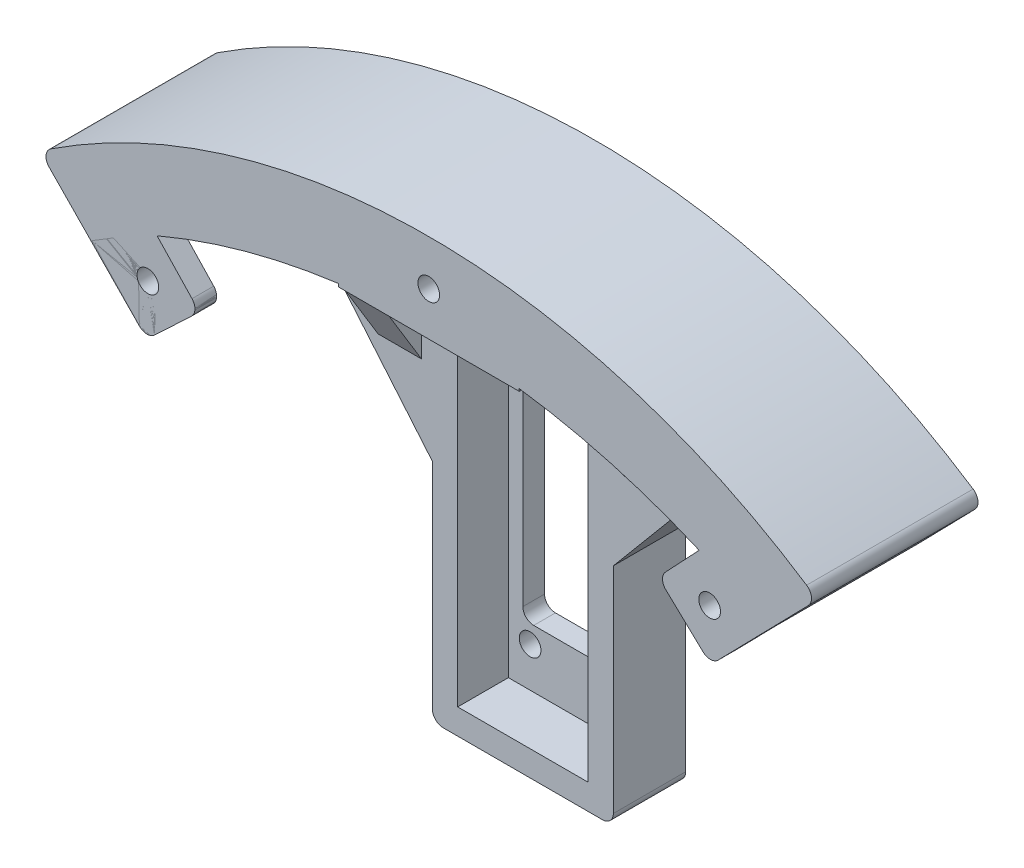
from build123d import *

# Parameters (mm, degrees)
CROQUIS1_R              = 100
SALIENTE_EXTRUIR1_DEPTH = 3
CROQUIS3_R              = 110
CORTAR_EXTRUIR1_DEPTH   = 3
REDONDEO1_R             = 10
CORTAR_EXTRUIR6_DEPTH   = 10
CROQUIS12_R             = 1.5
CORTAR_EXTRUIR7_DEPTH   = 142.453172607
CROQUIS9_R              = 1.5
CROQUIS9_W              = 4.5
CROQUIS9_H              = 8
CROQUIS9_W_2            = 8
CROQUIS9_H_2            = 4.5
CORTAR_EXTRUIR5_DEPTH   = 10
CORTAR_EXTRUIR9_DEPTH   = 142.453172607
SALIENTE_EXTRUIR3_DEPTH = 3
SALIENTE_EXTRUIR4_DEPTH = 23
CROQUIS23_W             = 25
CROQUIS23_H             = 75
SALIENTE_EXTRUIR5_DEPTH = 23
CROQUIS24_W             = 25
CROQUIS24_H             = 13
CORTAR_EXTRUIR10_DEPTH  = 58.5
CORTAR_EXTRUIR11_DEPTH  = 20
CROQUIS27_W             = 18
CROQUIS27_H             = 51.5
CORTAR_EXTRUIR12_DEPTH  = 7
CROQUIS28_R             = 1.5
CROQUIS28_W             = 14
CROQUIS28_H             = 37
CORTAR_EXTRUIR13_DEPTH  = 7
CROQUIS30_R             = 1.5
CORTAR_EXTRUIR14_DEPTH  = 5
REDONDEO2_R             = 1.5
REDONDEO3_R             = 1.5
REDONDEO4_R             = 1.5
CROQUIS33_R             = 100
CROQUIS33_R_2           = 95
CORTAR_EXTRUIR15_DEPTH  = 118.101726702
REDONDEO5_R             = 1.5
SALIENTE_EXTRUIR6_DEPTH = 10
SALIENTE_EXTRUIR7_DEPTH = 6


with BuildPart() as part:
    # Croquis1 → Saliente-Extruir1 (new body)
    with BuildSketch(Plane.XY):
        Circle(CROQUIS1_R)
    extrude(amount=SALIENTE_EXTRUIR1_DEPTH)

    # Croquis3 → Cortar-Extruir1 (cut)
    with BuildSketch(Plane.XY.offset(3)):
        with Locations((190, 0)):
            Circle(CROQUIS3_R)
    extrude(amount=-CORTAR_EXTRUIR1_DEPTH, mode=Mode.SUBTRACT)

    # Redondeo1
    redondeo1_edges = [part.edges().sort_by_distance(p)[0] for p in [
        (89.473684211, -44.659375654, 1.5),
        (89.473684211, 44.659375654, 1.5),
    ]]
    fillet(redondeo1_edges, radius=REDONDEO1_R)

    # Croquis5 → Cortar-Extruir6 (cut)
    with BuildSketch(Plane.XY.offset(3)):
        Polygon((-58.336309448, -83.085046789), (-83.085046789, -58.336309448), (-65.40737726, -40.658639918), (-40.658639918, -65.40737726), align=None)
        Polygon((-83.085046789, 58.336309448), (-58.336309448, 83.085046789), (-40.658639918, 65.40737726), (-65.40737726, 40.658639918), align=None)
        Polygon((58.336309448, -83.085046789), (83.085046789, -58.336309448), (65.40737726, -40.658639918), (40.658639918, -65.40737726), align=None)
        Polygon((58.336309448, 83.085046789), (83.085046789, 58.336309448), (65.40737726, 40.658639918), (40.658639918, 65.40737726), align=None)
    extrude(amount=-CORTAR_EXTRUIR6_DEPTH, mode=Mode.SUBTRACT)

    # Croquis12 → Cortar-Extruir7 (cut, through all)
    with BuildSketch(Plane.XY.offset(3)):
        with Locations((-63.604254904, -36.804908024)):
            Circle(CROQUIS12_R)
        with Locations((-36.804907897, -63.604255031)):
            Circle(CROQUIS12_R)
        with Locations((-47.666068056, -20.866721176)):
            Circle(CROQUIS12_R)
        with Locations((-20.866721049, -47.666068183)):
            Circle(CROQUIS12_R)
        with Locations(Location((47.666068183, 20.866721049, 0), (0, 0, 180))):
            Circle(CROQUIS12_R)
        with Locations(Location((20.866721176, 47.666068056, 0), (0, 0, 180))):
            Circle(CROQUIS12_R)
        with Locations(Location((63.604255031, 36.804907897, 0), (0, 0, 180))):
            Circle(CROQUIS12_R)
        with Locations(Location((36.804908024, 63.604254904, 0), (0, 0, 180))):
            Circle(CROQUIS12_R)
        with Locations((20.866721325, -47.666067908)):
            Circle(CROQUIS12_R)
        with Locations((47.666068332, -20.866720901)):
            Circle(CROQUIS12_R)
        with Locations((63.60425518, -36.804907749)):
            Circle(CROQUIS12_R)
        with Locations((36.804908173, -63.604254756)):
            Circle(CROQUIS12_R)
        with Locations(Location((-63.604254756, 36.804908173, 0), (0, 0, 180))):
            Circle(CROQUIS12_R)
        with Locations(Location((-36.804907749, 63.60425518, 0), (0, 0, 180))):
            Circle(CROQUIS12_R)
        with Locations(Location((-20.866720901, 47.666068332, 0), (0, 0, 180))):
            Circle(CROQUIS12_R)
        with Locations(Location((-47.666067908, 20.866721325, 0), (0, 0, 180))):
            Circle(CROQUIS12_R)
    extrude(amount=-CORTAR_EXTRUIR7_DEPTH, mode=Mode.SUBTRACT)

    # Croquis9 → Cortar-Extruir5 (cut)
    with BuildSketch(Plane.XY.offset(3)):
        with Locations((71.9, -4)):
            Circle(CROQUIS9_R)
        with Locations((35.959143483, 4)):
            Circle(CROQUIS9_R)
        with Locations((71.959143483, 4)):
            Circle(CROQUIS9_R)
        with Locations((35.9, -4)):
            Circle(CROQUIS9_R)
        with Locations((-91.190074744, 4)):
            Circle(CROQUIS9_R)
        with Locations((-91.190074744, -4)):
            Circle(CROQUIS9_R)
        with Locations((-55.190074744, 4)):
            Circle(CROQUIS9_R)
        with Locations((-55.190074744, -4)):
            Circle(CROQUIS9_R)
        with Locations((-4, 85)):
            Circle(CROQUIS9_R)
        with Locations((4, 85)):
            Circle(CROQUIS9_R)
        with Locations((-4, 49)):
            Circle(CROQUIS9_R)
        with Locations((4, 49)):
            Circle(CROQUIS9_R)
        with Locations((-4, -49)):
            Circle(CROQUIS9_R)
        with Locations((4, -49)):
            Circle(CROQUIS9_R)
        with Locations((4, -85)):
            Circle(CROQUIS9_R)
        with Locations((-4, -85)):
            Circle(CROQUIS9_R)
        with Locations((41.209143483, 0)):
            Rectangle(CROQUIS9_W, CROQUIS9_H)
        with Locations((0, -54.25)):
            Rectangle(CROQUIS9_W_2, CROQUIS9_H_2)
        with Locations((-60.440074744, 0)):
            Rectangle(CROQUIS9_W, CROQUIS9_H)
        with Locations((0, 54.25)):
            Rectangle(CROQUIS9_W_2, CROQUIS9_H_2)
    extrude(amount=-CORTAR_EXTRUIR5_DEPTH, mode=Mode.SUBTRACT)

    # Croquis13 → Cortar-Extruir9 (cut, through all)
    with BuildSketch(Plane.XY.offset(3)):
        with BuildLine():
            Line((-46.496345001, 71.245082342), (-40.658639918, 65.40737726))
            Line((-40.658639918, 65.40737726), (-65.40737726, 40.658639918))
            Line((-65.40737726, 40.658639918), (-81.993870249, 57.245132907))
            ThreePointArc((-81.993870249, 57.245132907), (-100, 0), (-81.993870249, -57.245132907))
            Line((-81.993870249, -57.245132907), (-65.40737726, -40.658639918))
            Line((-65.40737726, -40.658639918), (-40.658639918, -65.40737726))
            Line((-40.658639918, -65.40737726), (-57.245132907, -81.993870249))
            ThreePointArc((-57.245132907, -81.993870249), (0, -100), (57.245132907, -81.993870249))
            Line((57.245132907, -81.993870249), (40.658639918, -65.40737726))
            Line((40.658639918, -65.40737726), (65.40737726, -40.658639918))
            Line((65.40737726, -40.658639918), (81.993870249, -57.245132907))
            ThreePointArc((81.993870249, -57.245132907), (90.456214357, -50.775094972), (87.719298246, -40.480341508))
            ThreePointArc((87.719298246, -40.480341508), (80, 0), (87.719298246, 40.480341508))
            ThreePointArc((87.719298246, 40.480341508), (93.238979947, 51.725451206), (81.993870249, 57.245132907))
            Line((81.993870249, 57.245132907), (65.40737726, 40.658639918))
            Line((65.40737726, 40.658639918), (40.658639918, 65.40737726))
            Line((40.658639918, 65.40737726), (46.282518229, 71.031255571))
            ThreePointArc((46.282518229, 71.031255571), (-0.075166467, 84.913072149), (-46.496345001, 71.245082342))
        make_face()
    extrude(amount=-CORTAR_EXTRUIR9_DEPTH, mode=Mode.SUBTRACT)

    # Croquis14 → Saliente-Extruir3 (add)
    with BuildSketch(Plane(origin=(0, 0, 0), x_dir=(-1, 0, 0), z_dir=(0, 0, -1))):
        with BuildLine():
            Line((38.945518482, 63.246018717), (31.673642459, 70.110406462))
            Line((31.673642459, 70.110406462), (37.528482874, 76.312805746))
            ThreePointArc((37.528482874, 76.312805746), (42.081150122, 73.900579851), (46.496345001, 71.245082342))
            Line((46.496345001, 71.245082342), (38.945518482, 63.246018717))
        make_face()
        with BuildLine():
            Line((-38.945518482, 63.246018717), (-31.673642459, 70.110406462))
            Line((-31.673642459, 70.110406462), (-37.528482874, 76.312805746))
            ThreePointArc((-37.528482874, 76.312805746), (-42.081150122, 73.900579851), (-46.496345001, 71.245082342))
            Line((-46.496345001, 71.245082342), (-38.945518482, 63.246018717))
        make_face()
    extrude(amount=-SALIENTE_EXTRUIR3_DEPTH)


with BuildPart() as saliente_extruir3_piece_1:
    # of the separate pieces the step leaves, piece 1, a body of its own (saliente_extruir3_pieces)
    add(part.part.solids().sort_by_distance((38.945518482, 63.246018717, 0))[0])

    # Croquis15 → Saliente-Extruir4 (add)
    with BuildSketch(Plane.XY.offset(3)):
        with BuildLine():
            Line((57.245132907, 81.993870249), (38.945518482, 63.246018717))
            Line((38.945518482, 63.246018717), (31.673642459, 70.110406462))
            Line((31.673642459, 70.110406462), (37.356868188, 76.131003556))
            ThreePointArc((37.356868188, 76.131003556), (-0.067138098, 83.911872334), (-37.528482874, 76.312805746))
            Line((-37.528482874, 76.312805746), (-31.673642459, 70.110406462))
            Line((-31.673642459, 70.110406462), (-38.945518482, 63.246018717))
            Line((-38.945518482, 63.246018717), (-57.245132907, 81.993870249))
            ThreePointArc((-57.245132907, 81.993870249), (0, 100), (57.245132907, 81.993870249))
        make_face()
    extrude(amount=-SALIENTE_EXTRUIR4_DEPTH)

    # Croquis26 → Cortar-Extruir11 (cut)
    with BuildSketch(Plane(origin=(0, 0, -20), x_dir=(-1, 0, 0), z_dir=(0, 0, -1))):
        Polygon((-37.356868188, 76.131003556), (-31.673642459, 70.110406462), (-38.945518482, 63.246018717), (-44.729414099, 69.171587081), align=None)
        Polygon((31.673642459, 70.110406462), (38.945518482, 63.246018717), (44.729414099, 69.171587081), (37.356868188, 76.131003556), align=None)
    extrude(amount=-CORTAR_EXTRUIR11_DEPTH, mode=Mode.SUBTRACT)


with BuildPart() as saliente_extruir3_piece_2:
    # of the separate pieces the step leaves, piece 2, a body of its own (saliente_extruir3_pieces)
    add(part.part.solids().sort_by_distance((-31.673642459, 70.110406462, 0))[0])


with BuildPart() as body_3:
    # Croquis23 → Saliente-Extruir5 (new, through all)
    with BuildSketch(Plane(origin=(0, 0, -20), x_dir=(-1, 0, 0), z_dir=(0, 0, -1))):
        with Locations((0, 61.715674165)):
            Rectangle(CROQUIS23_W, CROQUIS23_H)
    extrude(amount=-SALIENTE_EXTRUIR5_DEPTH)

    # Croquis24 → Cortar-Extruir10 (cut)
    with BuildSketch(Plane.XZ.offset(-24.215674165)):
        with Locations((0, -3.5)):
            Rectangle(CROQUIS24_W, CROQUIS24_H)
    extrude(amount=-CORTAR_EXTRUIR10_DEPTH, mode=Mode.SUBTRACT)

    # Croquis27 → Cortar-Extruir12 (cut)
    with BuildSketch(Plane.XY.offset(-10)):
        with Locations((0, 53.465674165)):
            Rectangle(CROQUIS27_W, CROQUIS27_H)
    extrude(amount=-CORTAR_EXTRUIR12_DEPTH, mode=Mode.SUBTRACT)

    # Croquis28 → Cortar-Extruir13 (cut)
    with BuildSketch(Plane.XY.offset(-17)):
        with Locations((-6, 75.215674165)):
            Circle(CROQUIS28_R)
        with Locations((6, 75.215674165)):
            Circle(CROQUIS28_R)
        with Locations((-6, 33.215674165)):
            Circle(CROQUIS28_R)
        with Locations((6, 33.215674165)):
            Circle(CROQUIS28_R)
        with Locations((0, 54.215674165)):
            Rectangle(CROQUIS28_W, CROQUIS28_H)
    extrude(amount=-CORTAR_EXTRUIR13_DEPTH, mode=Mode.SUBTRACT)


with BuildPart() as cortar_extruir14_tool:
    # Croquis30 → Cortar-Extruir14 (new body)
    with BuildSketch(Plane.XY.offset(3)):
        with Locations((-38.800986703, 70.256139004)):
            Circle(CROQUIS30_R)
        with Locations((38.802062302, 70.257240949)):
            Circle(CROQUIS30_R)
        with Locations((0, 88.715674165)):
            Circle(CROQUIS30_R)
    extrude(amount=-CORTAR_EXTRUIR14_DEPTH)


with BuildPart() as saliente_extruir3_piece_1_1:
    add(saliente_extruir3_piece_1.part)

    # Cortar-Extruir14: cut by cortar_extruir14_tool
    add(cortar_extruir14_tool.part, mode=Mode.SUBTRACT)

    # Redondeo3
    redondeo3_edges = [saliente_extruir3_piece_1_1.edges().sort_by_distance(p)[0] for p in [
        (38.945518482, 63.246018717, 1.5),
        (31.673642459, 70.110406462, 1.5),
        (-57.245132907, 81.993870249, -8.5),
        (-38.945518482, 63.246018717, 1.5),
        (-31.673642459, 70.110406462, 1.5),
        (57.245132907, 81.993870249, -8.5),
    ]]
    fillet(redondeo3_edges, radius=REDONDEO3_R)


with BuildPart() as saliente_extruir3_piece_2_1:
    add(saliente_extruir3_piece_2.part)

    # Cortar-Extruir14: cut by cortar_extruir14_tool
    add(cortar_extruir14_tool.part, mode=Mode.SUBTRACT)

    # Redondeo4
    redondeo4_edges = [saliente_extruir3_piece_2_1.edges().sort_by_distance(p)[0] for p in [
        (-38.945518482, 63.246018717, 1.5),
        (-31.673642459, 70.110406462, 1.5),
    ]]
    fillet(redondeo4_edges, radius=REDONDEO4_R)


with BuildPart() as body_3_1:
    add(body_3.part)

    # Cortar-Extruir14: cut by cortar_extruir14_tool
    add(cortar_extruir14_tool.part, mode=Mode.SUBTRACT)

    # Redondeo2
    redondeo2_edges = [body_3_1.edges().sort_by_distance(p)[0] for p in [
        (12.5, 24.215674165, -15),
        (-12.5, 24.215674165, -15),
        (-7, 35.715674165, -18.5),
        (-7, 72.715674165, -18.5),
        (7, 72.715674165, -18.5),
        (7, 35.715674165, -18.5),
    ]]
    fillet(redondeo2_edges, radius=REDONDEO2_R)


with BuildPart() as cortar_extruir15_tool:
    # Croquis33 → Cortar-Extruir15 (new, through all)
    with BuildSketch(Plane.XY.offset(3)):
        Circle(CROQUIS33_R)
        Circle(CROQUIS33_R_2, mode=Mode.SUBTRACT)
    extrude(amount=-CORTAR_EXTRUIR15_DEPTH)


with BuildPart() as saliente_extruir3_piece_1_2:
    add(saliente_extruir3_piece_1_1.part)

    # Cortar-Extruir15: cut by cortar_extruir15_tool
    add(cortar_extruir15_tool.part, mode=Mode.SUBTRACT)

    # Redondeo5
    redondeo5_edges = [saliente_extruir3_piece_1_2.edges().sort_by_distance(p)[0] for p in [
        (53.702695744, 78.3646634, -8.5),
        (-53.702695744, 78.3646634, -8.5),
    ]]
    fillet(redondeo5_edges, radius=REDONDEO5_R)



with BuildPart() as body_3_2:
    add(body_3_1.part)

    # Cortar-Extruir15: cut by cortar_extruir15_tool
    add(cortar_extruir15_tool.part, mode=Mode.SUBTRACT)


with BuildPart() as saliente_extruir3_piece_1_3:
    add(saliente_extruir3_piece_1_2.part)

    add(body_3_2.part)  # Saliente-Extruir6 merges body 3
    # Croquis36 → Saliente-Extruir6 (add)
    with BuildSketch(Plane(origin=(0, 0, -20), x_dir=(-1, 0, 0), z_dir=(0, 0, -1))):
        Polygon((-12.5, 55.3499652), (-31.783628291, 78.331298493), (-12.5, 85.3499652), align=None)
        Polygon((12.5, 55.3499652), (31.783628291, 78.331298493), (12.5, 85.3499652), align=None)
    extrude(amount=-SALIENTE_EXTRUIR6_DEPTH)

    # Croquis37 → Saliente-Extruir7 (add)
    with BuildSketch(Plane(origin=(20, 0, 0), x_dir=(0, 0, -1), z_dir=(1, 0, 0))):
        Polygon((10, 66.840631847), (-3, 88.194788351), (10, 88.194788351), align=None)
    saliente_extruir7 = extrude(amount=-SALIENTE_EXTRUIR7_DEPTH)

    # Simetría1: Saliente-Extruir7 across plane
    add(saliente_extruir7.mirror(Plane(origin=(0, 0, 0), x_dir=(0, 0, 1), z_dir=(1, 0, 0))))


solid = Compound([saliente_extruir3_piece_2_1.part, saliente_extruir3_piece_1_3.part])
